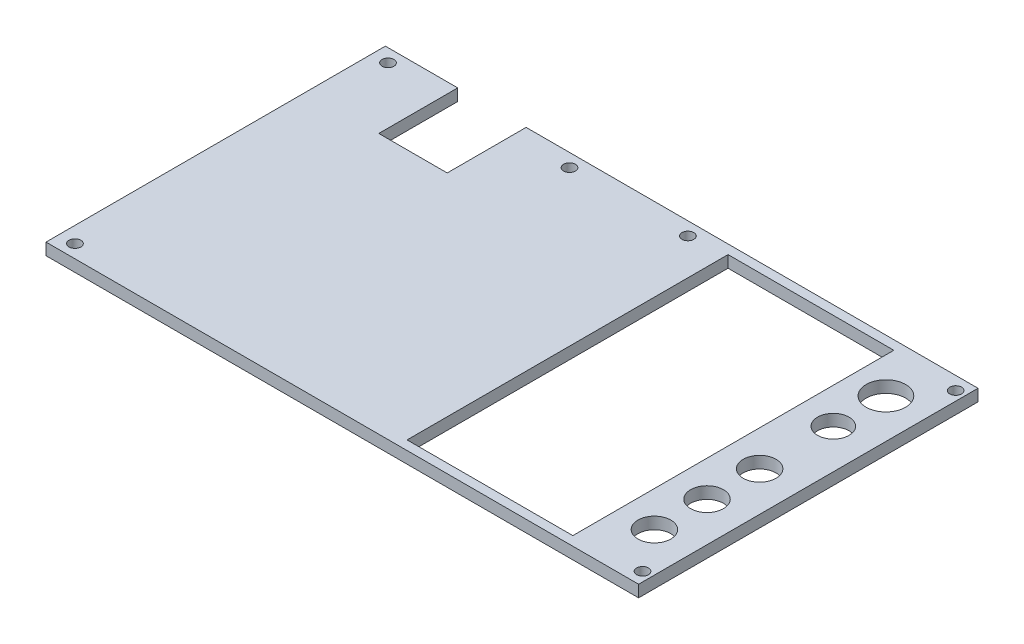
from build123d import *

# Parameters (mm, degrees)
SKETCH1_W                = 225.24
SKETCH1_H                = 129
BOSS_EXTRUDE1_DEPTH      = 2.25
SKETCH2_W                = 63
SKETCH2_H                = 122
CUT_EXTRUDE1_DEPTH       = 130.860557522
SKETCH3_R                = 6.25
SKETCH3_R_2              = 6
SKETCH3_R_3              = 7.5
CUT_EXTRUDE2_DEPTH       = 130.860557522
SKETCH4_W                = 26
SKETCH4_H                = 30
CUT_EXTRUDE3_DEPTH       = 130.860557522
M4_CLEARANCE_HOLE1_D     = 4.5
M4_CLEARANCE_HOLE1_DEPTH = 12
M4_CLEARANCE_HOLE1_TIP   = 1.351936393


with BuildPart() as part:
    # Sketch1 → Boss-Extrude1 (new, symmetric)
    with BuildSketch(Plane(origin=(0, 0, 0), x_dir=(1, 0, 0), z_dir=(0, 1, 0))):
        Rectangle(SKETCH1_W, SKETCH1_H)
    extrude(amount=BOSS_EXTRUDE1_DEPTH, both=True)

    # Sketch2 → Cut-Extrude1 (cut, through all)
    with BuildSketch(Plane(origin=(0, 2.25, 0), x_dir=(1, 0, 0), z_dir=(0, 1, 0))):
        with Locations((52.62, 0)):
            Rectangle(SKETCH2_W, SKETCH2_H)
    extrude(amount=-CUT_EXTRUDE1_DEPTH, mode=Mode.SUBTRACT)

    # Sketch3 → Cut-Extrude2 (cut, through all)
    with BuildSketch(Plane(origin=(0, 2.25, 0), x_dir=(1, 0, 0), z_dir=(0, 1, 0))):
        with Locations(Location((97.62, -43.5, 0), (0, 0, 270))):
            Circle(SKETCH3_R)
        with Locations(Location((97.62, -23.5, 0), (0, 0, 270))):
            Circle(SKETCH3_R)
        with Locations(Location((97.62, -3.5, 0), (0, 0, 270))):
            Circle(SKETCH3_R)
        with Locations(Location((97.62, 24.5, 0), (0, 0, 270))):
            Circle(SKETCH3_R_2)
        with Locations(Location((97.62, 44.5, 0), (0, 0, 270))):
            Circle(SKETCH3_R_3)
    extrude(amount=-CUT_EXTRUDE2_DEPTH, mode=Mode.SUBTRACT)

    # Sketch4 → Cut-Extrude3 (cut, through all)
    with BuildSketch(Plane(origin=(0, 2.25, 0), x_dir=(1, 0, 0), z_dir=(0, 1, 0))):
        with Locations((-72.13, 49.5)):
            Rectangle(SKETCH4_W, SKETCH4_H)
    extrude(amount=-CUT_EXTRUDE3_DEPTH, mode=Mode.SUBTRACT)

    # M4 Clearance Hole1
    with Locations(Plane(origin=(0, 2.25, 0), x_dir=(1, 0, 0), z_dir=(0, 1, 0))):
        with Locations((-106.62, -59.5), (-106.62, 59.5), (-37.64, 59.5), (7.36, 59.5), (109.12, 59.5), (109.12, -59.5)):
            Hole(M4_CLEARANCE_HOLE1_D / 2, depth=M4_CLEARANCE_HOLE1_DEPTH)
            with Locations((0, 0, -(M4_CLEARANCE_HOLE1_DEPTH + M4_CLEARANCE_HOLE1_TIP / 2))):  # 118° drill point
                Cone(0, M4_CLEARANCE_HOLE1_D / 2, M4_CLEARANCE_HOLE1_TIP, mode=Mode.SUBTRACT)


solid = part.part
